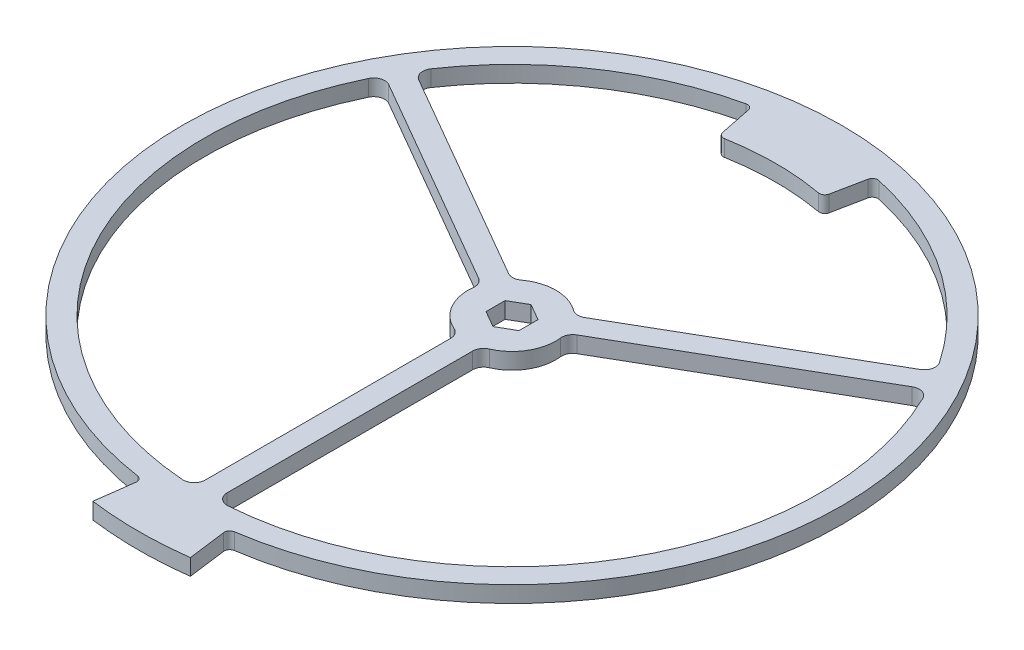
from build123d import *

# Parameters (mm, degrees)
SKETCH1_R                = 95.25
SKETCH1_R_2              = 88.9
BOSS_EXTRUDE1_DEPTH      = 4.699
BOSS_EXTRUDE2_DEPTH      = 4.699
SKETCH3_R                = 12.7
BOSS_EXTRUDE3_DEPTH      = 4.699
BOSS_EXTRUDE4_DEPTH      = 4.699
FILLET1_R                = 3.175
CIRPATTERN1_COUNT        = 3
FILLET1_OF_CIRPATTERN1_R = 3.175
FILLET2_R                = 1.5875


with BuildPart() as part:
    # Sketch1 → Boss-Extrude1 (new body)
    with BuildSketch(Plane(origin=(0, 0, 0), x_dir=(1, 0, 0), z_dir=(0, 1, 0))):
        with Locations(Location((0, 0, 0), (0, 0, 270))):
            Circle(SKETCH1_R)
        with Locations(Location((0, 0, 0), (0, 0, 270))):
            Circle(SKETCH1_R_2, mode=Mode.SUBTRACT)
    extrude(amount=BOSS_EXTRUDE1_DEPTH)

    # Sketch2 → Boss-Extrude2 (add)
    with BuildSketch(Plane.XZ):
        with BuildLine():
            ThreePointArc((14.09030245, 107.026472785), (0, 107.95), (-14.09030245, 107.026472785))
            Line((-14.09030245, 107.026472785), (-12.432619809, 94.435123046))
            ThreePointArc((-12.432619809, 94.435123046), (0, 95.25), (12.432619809, 94.435123046))
            Line((12.432619809, 94.435123046), (14.09030245, 107.026472785))
        make_face()
        with BuildLine():
            Line((-15.09408047, -74.690084581), (-17.609760548, -87.138432012))
            ThreePointArc((-17.609760548, -87.138432012), (0, -88.9), (17.609760548, -87.138432012))
            Line((17.609760548, -87.138432012), (15.09408047, -74.690084581))
            ThreePointArc((15.09408047, -74.690084581), (0, -76.2), (-15.09408047, -74.690084581))
        make_face()
    extrude(amount=-BOSS_EXTRUDE2_DEPTH)



with BuildPart() as body_2:
    # Sketch3 → Boss-Extrude3 (new body)
    with BuildSketch(Plane.XZ):
        with Locations(Location((0, 0, 0), (0, 0, 270))):
            Circle(SKETCH3_R)
        Polygon((0, 5.499261314), (-4.7625, 2.749630657), (-4.7625, -2.749630657), (0, -5.499261314), (4.7625, -2.749630657), (4.7625, 2.749630657), align=None, mode=Mode.SUBTRACT)
    extrude(amount=-BOSS_EXTRUDE3_DEPTH)


with BuildPart() as part_1:
    add(part.part)

    add(body_2.part)  # Boss-Extrude4 merges body 2
    # Sketch4 → Boss-Extrude4 (add)
    with BuildSketch(Plane(origin=(0, 0, 0), x_dir=(-1, 0, 0), z_dir=(0, -1, 0))):
        with BuildLine():
            Line((3.175, -88.843285481), (3.175, -12.296722124))
            ThreePointArc((3.175, -12.296722124), (0, -12.7), (-3.175, -12.296722124))
            Line((-3.175, -12.296722124), (-3.175, -88.843285481))
            ThreePointArc((-3.175, -88.843285481), (0, -88.9), (3.175, -88.843285481))
        make_face()
    boss_extrude4 = extrude(amount=-BOSS_EXTRUDE4_DEPTH)

    # Fillet1
    fillet1_edges = [part_1.edges().sort_by_distance(p)[0] for p in [
        (-3.175, 2.3495, 12.296722124),
        (3.175, 2.3495, 12.296722124),
        (3.175, 2.3495, 88.843285481),
        (-3.175, 2.3495, 88.843285481),
    ]]
    fillet(fillet1_edges, radius=FILLET1_R)

    # CirPattern1: Boss-Extrude4 ×3 about axis
    cirpattern1_axis = Axis((0, 0, 0), (0, 1, 0))
    for i in range(1, CIRPATTERN1_COUNT):
        add(boss_extrude4.rotate(cirpattern1_axis, i * 360 / CIRPATTERN1_COUNT))

    # Fillet1 of CirPattern1
    fillet1_of_cirpattern1_edges = [part_1.edges().sort_by_distance(p)[0] for p in [
        (12.236773743, 2.3495, -3.398730405),
        (9.061773743, 2.3495, -8.897991719),
        (75.353042182, 2.3495, -47.171273397),
        (78.528042182, 2.3495, -41.672012083),
        (-9.061773743, 2.3495, -8.897991719),
        (-12.236773743, 2.3495, -3.398730405),
        (-78.528042182, 2.3495, -41.672012083),
        (-75.353042182, 2.3495, -47.171273397),
    ]]
    fillet(fillet1_of_cirpattern1_edges, radius=FILLET1_OF_CIRPATTERN1_R)

    # Fillet2
    fillet2_edges = [part_1.edges().sort_by_distance(p)[0] for p in [
        (-15.09408047, 2.3495, -74.690084581),
        (15.09408047, 2.3495, -74.690084581),
        (17.609760548, 2.3495, -87.138432012),
        (-17.609760548, 2.3495, -87.138432012),
        (-12.432619809, 2.3495, 94.435123046),
        (12.432619809, 2.3495, 94.435123046),
    ]]
    fillet(fillet2_edges, radius=FILLET2_R)


solid = part_1.part
